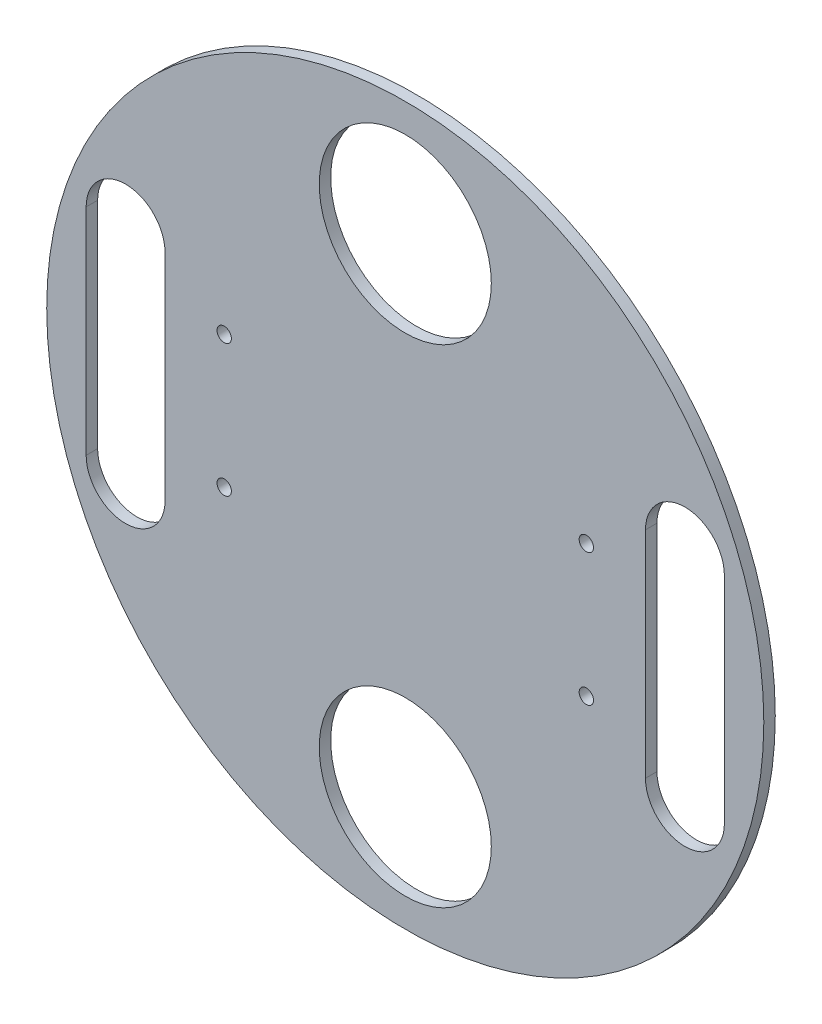
from build123d import *

# Parameters (mm, degrees)
ESQUISSE1_R               = 50
BOSS_EXTRU_1_DEPTH        = 1.6
ENL_V_MAT_EXTRU_1_DEPTH   = 1.6
ESQUISSE4_R               = 12
ENL_V_MAT_EXTRU_3_DEPTH   = 1.6
ESQUISSE7_R               = 1
ENL_V_MAT_EXTRU_4_DEPTH   = 1.6
SYM_TRIE8_COPY_1_SKETCH_R = 1
SYM_TRIE8_COPY_1_DEPTH    = 1.6


with BuildPart() as part:
    # Esquisse1 → Boss.-Extru.1 (new body)
    with BuildSketch(Plane.XY):
        Circle(ESQUISSE1_R)
    extrude(amount=BOSS_EXTRU_1_DEPTH)

    # Esquisse2 → Enlèv. mat.-Extru.1 (cut)
    with BuildSketch(Plane.XY.offset(1.6)):
        with BuildLine():
            Line((-33.5, 15), (-33.5, -15))
            ThreePointArc((-33.5, -15), (-39, -20.5), (-44.5, -15))
            Line((-44.5, -15), (-44.5, 15))
            ThreePointArc((-44.5, 15), (-39, 20.5), (-33.5, 15))
        make_face()
    enl_v_mat_extru_1 = extrude(amount=-ENL_V_MAT_EXTRU_1_DEPTH, mode=Mode.SUBTRACT)

    # Symétrie1: Enlèv. mat.-Extru.1 across plane
    add(enl_v_mat_extru_1.mirror(Plane(origin=(0, 0, 0), x_dir=(0, 0, 1), z_dir=(1, 0, 0))), mode=Mode.SUBTRACT)

    # Esquisse4 → Enlèv. mat.-Extru.3 (cut)
    with BuildSketch(Plane.XY.offset(1.6)):
        with Locations((0, 34)):
            Circle(ESQUISSE4_R)
    enl_v_mat_extru_3 = extrude(amount=-ENL_V_MAT_EXTRU_3_DEPTH, mode=Mode.SUBTRACT)

    # Symétrie6: Enlèv. mat.-Extru.3 across plane
    add(enl_v_mat_extru_3.mirror(Plane.ZX), mode=Mode.SUBTRACT)

    # Esquisse7 → Enlèv. mat.-Extru.4 (cut)
    with BuildSketch(Plane.XY.offset(1.6)):
        with Locations((25.25, -9.221094574)):
            Circle(ESQUISSE7_R)
    enl_v_mat_extru_4 = extrude(amount=-ENL_V_MAT_EXTRU_4_DEPTH, mode=Mode.SUBTRACT)

    # Symétrie7: Enlèv. mat.-Extru.4 across plane
    add(enl_v_mat_extru_4.mirror(Plane.ZX), mode=Mode.SUBTRACT)

    # Symétrie8: Enlèv. mat.-Extru.4 across plane
    add(enl_v_mat_extru_4.mirror(Plane(origin=(0, 0, 0), x_dir=(0, 0, 1), z_dir=(1, 0, 0))), mode=Mode.SUBTRACT)

    # Symétrie8 copy 1 sketch → Symétrie8 copy 1 (cut)
    with BuildSketch(Plane(origin=(0, 0, 1.6), x_dir=(-1, 0, 0), z_dir=(0, 0, 1))):
        with Locations((25.25, -9.221094574)):
            Circle(SYM_TRIE8_COPY_1_SKETCH_R)
    extrude(amount=-SYM_TRIE8_COPY_1_DEPTH, mode=Mode.SUBTRACT)


solid = part.part
